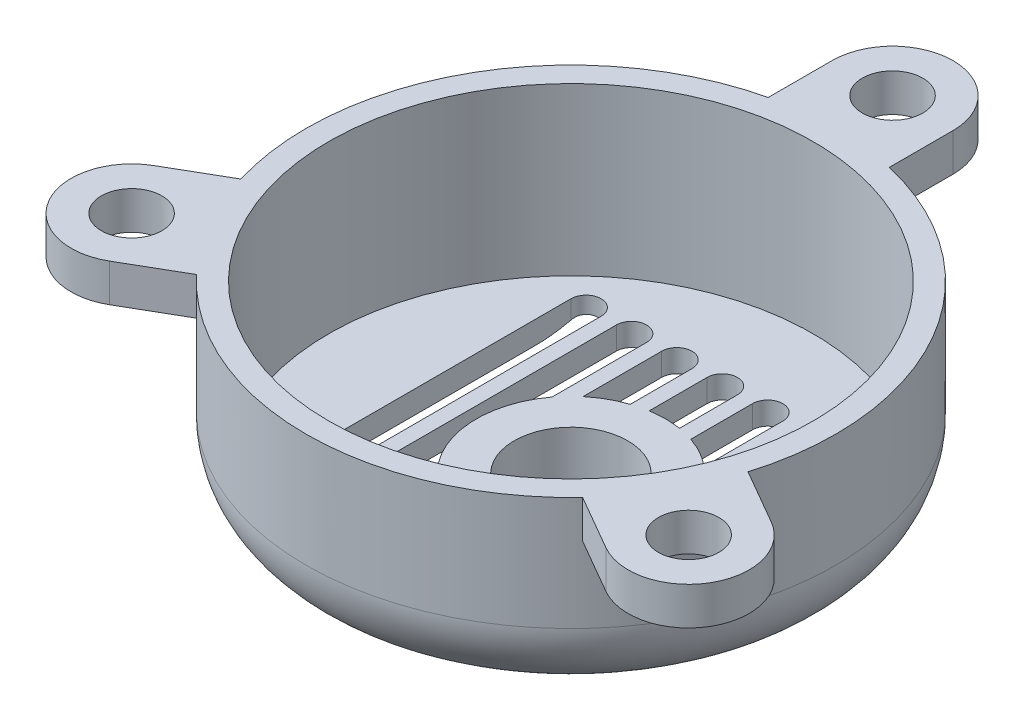
from build123d import *

# Parameters (mm, degrees)
SKETCH1_R                = 35
BOSS_EXTRUDE1_DEPTH      = 25
SHELL1_T                 = -3
FILLET1_R                = 10
BOSS_EXTRUDE2_START      = -5
SKETCH4_R                = 4
BOSS_EXTRUDE2_DEPTH      = 5
CIRPATTERN1_COUNT        = 3
CUT_EXTRUDE1_DEPTH       = 72.991907702
BOSS_EXTRUDE3_DEPTH      = 5
BOSS_EXTRUDE3_DEPTH_BACK = 3
SKETCH7_R                = 12.5
FILLET2_R                = 2
SKETCH8_R                = 7.5
CUT_EXTRUDE2_DEPTH       = 74.877160033


with BuildPart() as part:
    # Sketch1 → Boss-Extrude1 (new body)
    with BuildSketch(Plane(origin=(0, 0, 0), x_dir=(1, 0, 0), z_dir=(0, 1, 0))):
        with Locations(Location((0, 0, 0), (0, 0, 270))):
            Circle(SKETCH1_R)
    extrude(amount=BOSS_EXTRUDE1_DEPTH)

    # Shell1
    shell1_openings = [part.faces().sort_by_distance(p)[0] for p in [
        (0, 25, 0),
    ]]
    offset(amount=SHELL1_T, openings=shell1_openings, kind=Kind.INTERSECTION)

    # Fillet1
    fillet1_edges = [part.edges().sort_by_distance(p)[0] for p in [
        (0, 0, -35),
    ]]
    fillet(fillet1_edges, radius=FILLET1_R)

    # Sketch4 → Boss-Extrude2 (add)
    with BuildSketch(Plane(origin=(0, 25, 0), x_dir=(1, 0, 0), z_dir=(0, 1, 0)).offset(BOSS_EXTRUDE2_START)):
        with BuildLine():
            Line((-8, 42.5), (-8, 34.073450075))
            ThreePointArc((-8, 34.073450075), (0, 35), (8, 34.073450075))
            Line((8, 34.073450075), (8, 42.5))
            ThreePointArc((8, 42.5), (0, 50.5), (-8, 42.5))
        make_face()
        with Locations(Location((0, 42.5, 0), (0, 0, 270))):
            Circle(SKETCH4_R, mode=Mode.SUBTRACT)
    boss_extrude2 = extrude(amount=BOSS_EXTRUDE2_DEPTH)

    # CirPattern1: Boss-Extrude2 ×3 about axis
    cirpattern1_axis = Axis((0, 0, 0), (0, 1, 0))
    for i in range(1, CIRPATTERN1_COUNT):
        add(boss_extrude2.rotate(cirpattern1_axis, i * 360 / CIRPATTERN1_COUNT))

    # Sketch5 → Cut-Extrude1 (cut, through all)
    with BuildSketch(Plane.XZ):
        with BuildLine():
            Line((-16, 20), (-16, -20))
            ThreePointArc((-16, -20), (-18, -22), (-20, -20))
            Line((-20, -20), (-20, 20))
            ThreePointArc((-20, 20), (-18, 22), (-16, 20))
        make_face()
        with BuildLine():
            Line((-10, 20), (-10, -20))
            ThreePointArc((-10, -20), (-12, -22), (-14, -20))
            Line((-14, -20), (-14, 20))
            ThreePointArc((-14, 20), (-12, 22), (-10, 20))
        make_face()
        with BuildLine():
            Line((-4, 20), (-4, -20))
            ThreePointArc((-4, -20), (-6, -22), (-8, -20))
            Line((-8, -20), (-8, 20))
            ThreePointArc((-8, 20), (-6, 22), (-4, 20))
        make_face()
        with BuildLine():
            Line((2, 20), (2, -20))
            ThreePointArc((2, -20), (0, -22), (-2, -20))
            Line((-2, -20), (-2, 20))
            ThreePointArc((-2, 20), (0, 22), (2, 20))
        make_face()
        with BuildLine():
            Line((8, 20), (8, -20))
            ThreePointArc((8, -20), (6, -22), (4, -20))
            Line((4, -20), (4, 20))
            ThreePointArc((4, 20), (6, 22), (8, 20))
        make_face()
        with BuildLine():
            Line((14, 20), (14, -20))
            ThreePointArc((14, -20), (12, -22), (10, -20))
            Line((10, -20), (10, 20))
            ThreePointArc((10, 20), (12, 22), (14, 20))
        make_face()
        with BuildLine():
            Line((20, 20), (20, -20))
            ThreePointArc((20, -20), (18, -22), (16, -20))
            Line((16, -20), (16, 20))
            ThreePointArc((16, 20), (18, 22), (20, 20))
        make_face()
    extrude(amount=-CUT_EXTRUDE1_DEPTH, mode=Mode.SUBTRACT)

    # Sketch7 → Boss-Extrude3 (add, two sides: drawn at the far end of the back side and taken through both)
    with BuildSketch(Plane.XZ.offset(-BOSS_EXTRUDE3_DEPTH_BACK)):
        with Locations(Location((0, 0, 0), (0, 0, 270))):
            Circle(SKETCH7_R)
    extrude(amount=BOSS_EXTRUDE3_DEPTH + BOSS_EXTRUDE3_DEPTH_BACK)

    # Fillet2
    fillet2_edges = [part.edges().sort_by_distance(p)[0] for p in [
        (0, -5, 12.5),
    ]]
    fillet(fillet2_edges, radius=FILLET2_R)

    # Sketch8 → Cut-Extrude2 (cut, through all)
    with BuildSketch(Plane.XZ.offset(5)):
        with Locations(Location((0, 0, 0), (0, 0, 270))):
            Circle(SKETCH8_R)
    extrude(amount=-CUT_EXTRUDE2_DEPTH, mode=Mode.SUBTRACT)


solid = part.part
